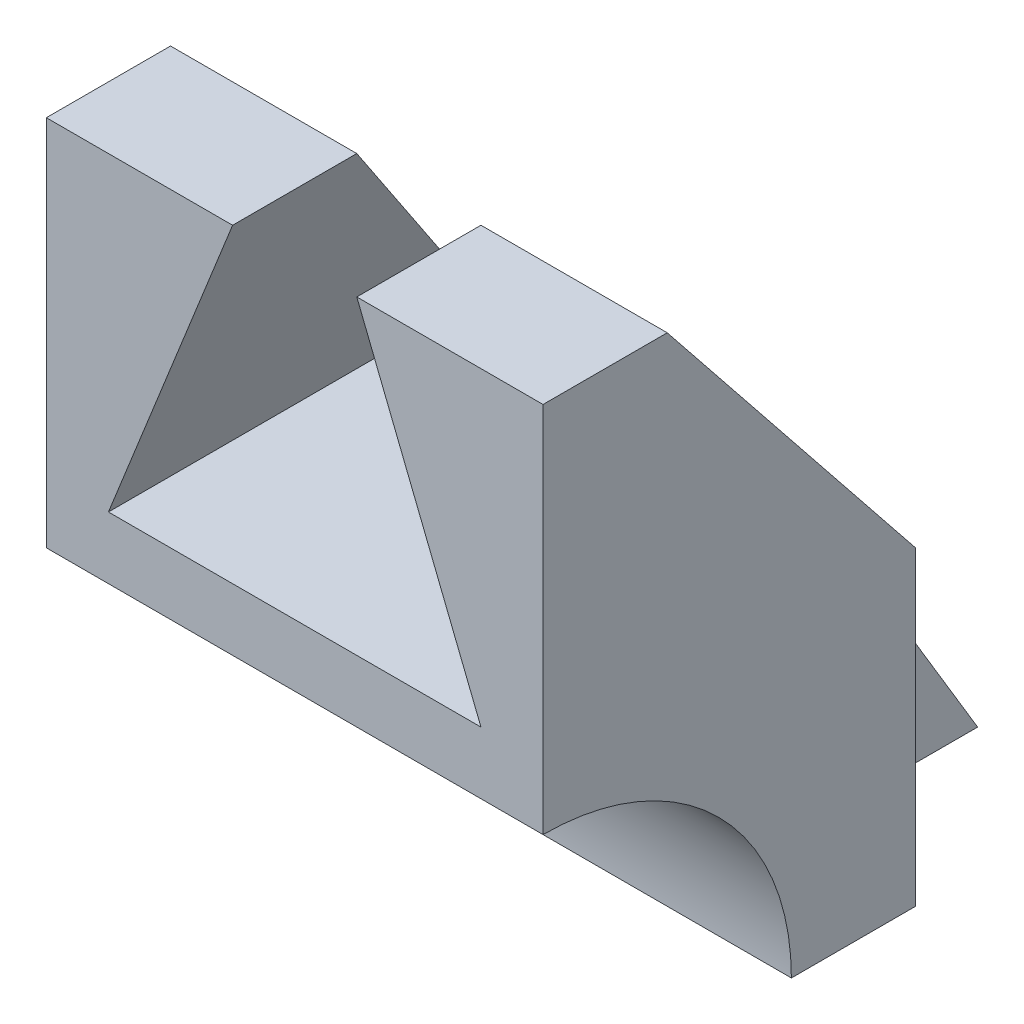
from build123d import *

# Parameters (mm, degrees)
BOSS_EXTRUDE1_DEPTH = 20
BOSS_EXTRUDE2_DEPTH = 10
CUT_EXTRUDE1_DEPTH  = 71.178344238


with BuildPart() as part:
    # Sketch1 → Boss-Extrude1 (new, symmetric)
    with BuildSketch(Plane(origin=(0, 0, 0), x_dir=(0, 0, -1), z_dir=(1, 0, 0))):
        with BuildLine():
            Line((10, 50), (0, 50))
            Line((0, 50), (0, 20))
            ThreePointArc((0, 20), (14.142135624, 14.142135624), (20, 0))
            Line((20, 0), (30, 0))
            Line((30, 0), (30, 25))
            Line((30, 25), (10, 50))
        make_face()
    extrude(amount=BOSS_EXTRUDE1_DEPTH, both=True)

    # Sketch1<3> → Boss-Extrude2 (add, symmetric)
    with BuildSketch(Plane(origin=(0, 0, 0), x_dir=(0, 0, -1), z_dir=(1, 0, 0))):
        Polygon((45, 0), (30, 25), (30, 0), align=None)
    extrude(amount=BOSS_EXTRUDE2_DEPTH, both=True)

    # Sketch2 → Cut-Extrude1 (cut, through all)
    with BuildSketch(Plane.XY):
        Polygon((15, 25), (5, 50), (-5, 50), (-15, 25), align=None)
    extrude(amount=-CUT_EXTRUDE1_DEPTH, mode=Mode.SUBTRACT)


solid = part.part
